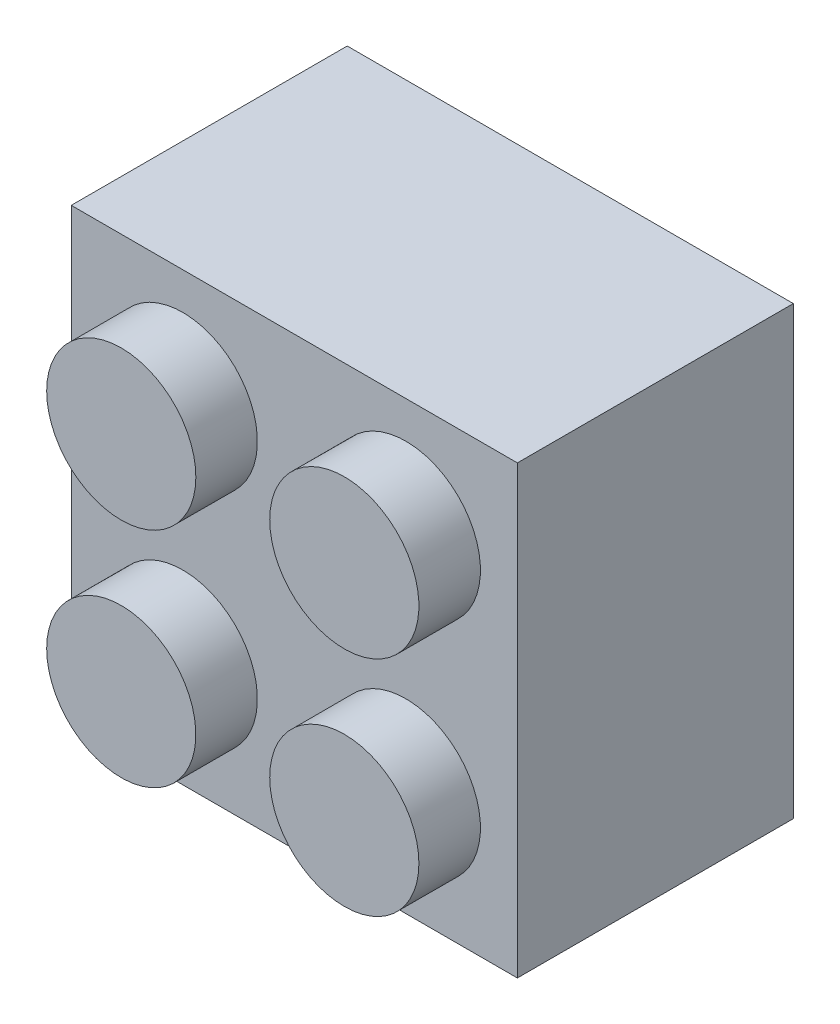
from build123d import *

# Parameters (mm, degrees)
ESQUISSE2_W             = 95.7
ESQUISSE2_H             = 95.7
BOSS_EXTRU_1_DEPTH      = 59.2
ESQUISSE3_R             = 16
BOSS_EXTRU_2_DEPTH      = 13.2
ESQUISSE4_W             = 78.5
ESQUISSE4_H             = 78.5
ESQUISSE4_R             = 17.15
ESQUISSE4_R_2           = 9.75
ENL_V_MAT_EXTRU_1_DEPTH = 51.1


with BuildPart() as part:
    # Esquisse2 → Boss.-Extru.1 (new body)
    with BuildSketch(Plane.XY):
        with Locations((47.85, 47.85)):
            Rectangle(ESQUISSE2_W, ESQUISSE2_H)
    extrude(amount=BOSS_EXTRU_1_DEPTH)

    # Esquisse3 → Boss.-Extru.2 (add)
    with BuildSketch(Plane.XY.offset(59.2)):
        with Locations(Location((23.925, 71.775, 0), (0, 0, 180))):
            Circle(ESQUISSE3_R)
        with Locations(Location((71.775, 71.775, 0), (0, 0, 180))):
            Circle(ESQUISSE3_R)
        with Locations(Location((71.775, 23.925, 0), (0, 0, 180))):
            Circle(ESQUISSE3_R)
        with Locations(Location((23.925, 23.925, 0), (0, 0, 180))):
            Circle(ESQUISSE3_R)
    extrude(amount=BOSS_EXTRU_2_DEPTH)

    # Esquisse4 → Enlèv. mat.-Extru.1 (cut)
    # profile 1 of 2: a face of its own
    with BuildSketch(Plane(origin=(0, 0, 0), x_dir=(-1, 0, 0), z_dir=(0, 0, -1))):
        with Locations((-47.85, 47.85)):
            Rectangle(ESQUISSE4_W, ESQUISSE4_H)
        with Locations((-47.85, 47.85)):
            Circle(ESQUISSE4_R, mode=Mode.SUBTRACT)
    # profile 2 of 2: a face of its own
    with BuildSketch(Plane(origin=(0, 0, 0), x_dir=(-1, 0, 0), z_dir=(0, 0, -1))):
        with Locations((-47.85, 47.85)):
            Circle(ESQUISSE4_R_2)
    extrude(amount=-ENL_V_MAT_EXTRU_1_DEPTH, mode=Mode.SUBTRACT)


solid = part.part
